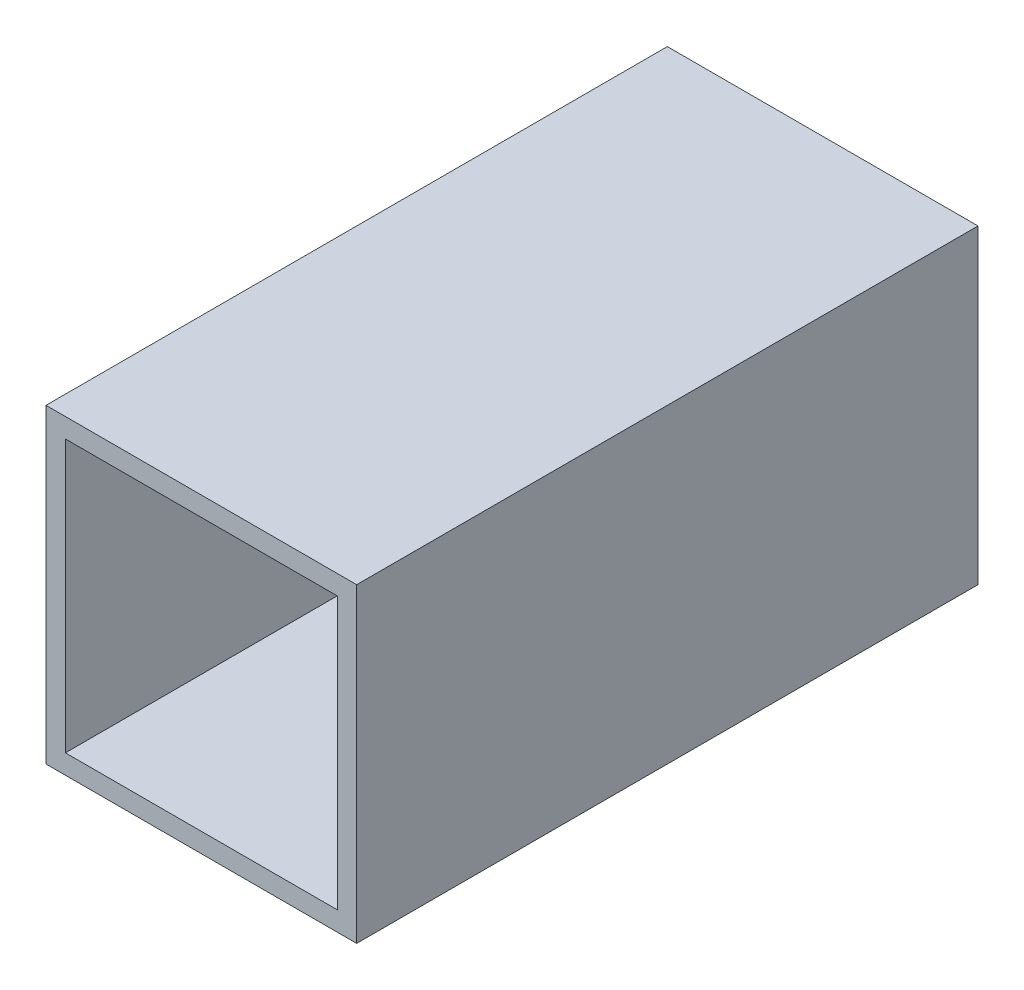
from build123d import *

# Parameters (mm, degrees)
SKETCH1_W           = 25.4
SKETCH1_H           = 25.4
SKETCH1_W_2         = 22.225
SKETCH1_H_2         = 22.225
BOSS_EXTRUDE1_DEPTH = 50.8


with BuildPart() as part:
    # Sketch1 → Boss-Extrude1 (new body)
    with BuildSketch(Plane.XY):
        Rectangle(SKETCH1_W, SKETCH1_H)
        Rectangle(SKETCH1_W_2, SKETCH1_H_2, mode=Mode.SUBTRACT)
    extrude(amount=BOSS_EXTRUDE1_DEPTH)


solid = part.part
